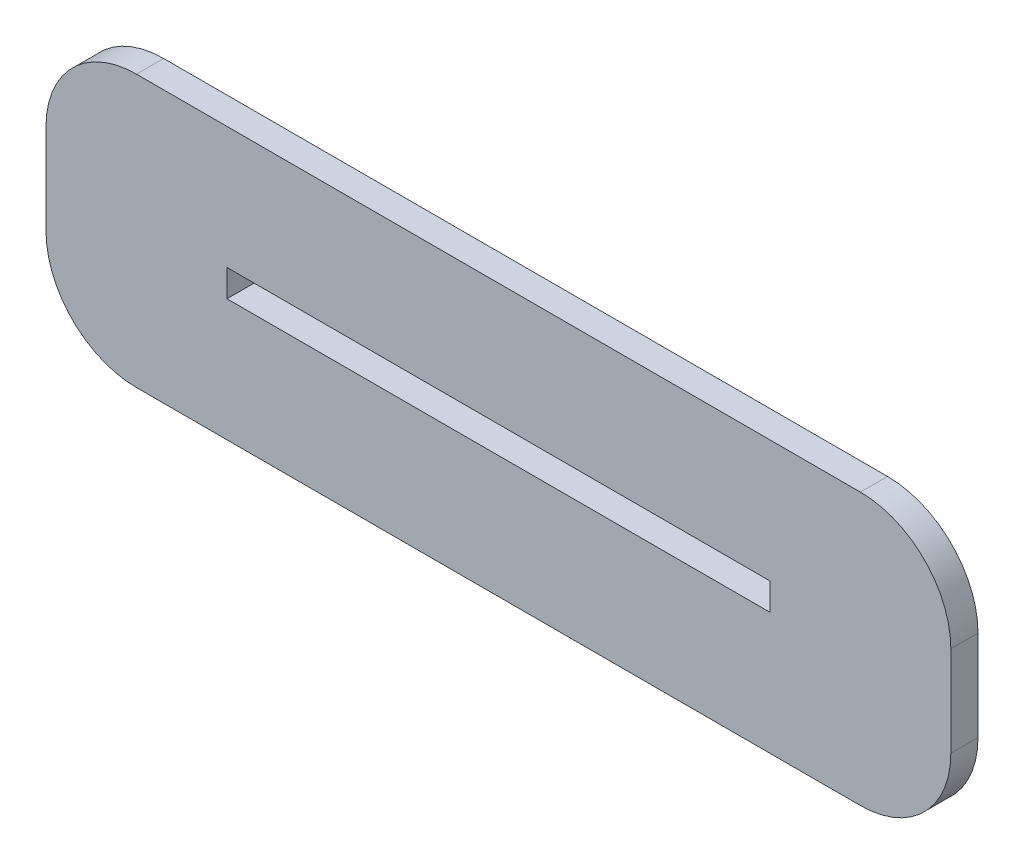
from build123d import *

# Parameters (mm, degrees)
SKETCH1_W           = 100
SKETCH1_H           = 30
SKETCH1_W_2         = 60
SKETCH1_H_2         = 3
BOSS_EXTRUDE1_DEPTH = 3
FILLET1_R           = 10


with BuildPart() as part:
    # Sketch1 → Boss-Extrude1 (new body)
    with BuildSketch(Plane.XY):
        with Locations((50, 15)):
            Rectangle(SKETCH1_W, SKETCH1_H)
        with Locations((50, 15)):
            Rectangle(SKETCH1_W_2, SKETCH1_H_2, mode=Mode.SUBTRACT)
    extrude(amount=BOSS_EXTRUDE1_DEPTH)

    # Fillet1
    fillet1_edges = [part.edges().sort_by_distance(p)[0] for p in [
        (0, 30, 1.5),
        (100, 30, 1.5),
        (100, 0, 1.5),
        (0, 0, 1.5),
    ]]
    fillet(fillet1_edges, radius=FILLET1_R)


solid = part.part
